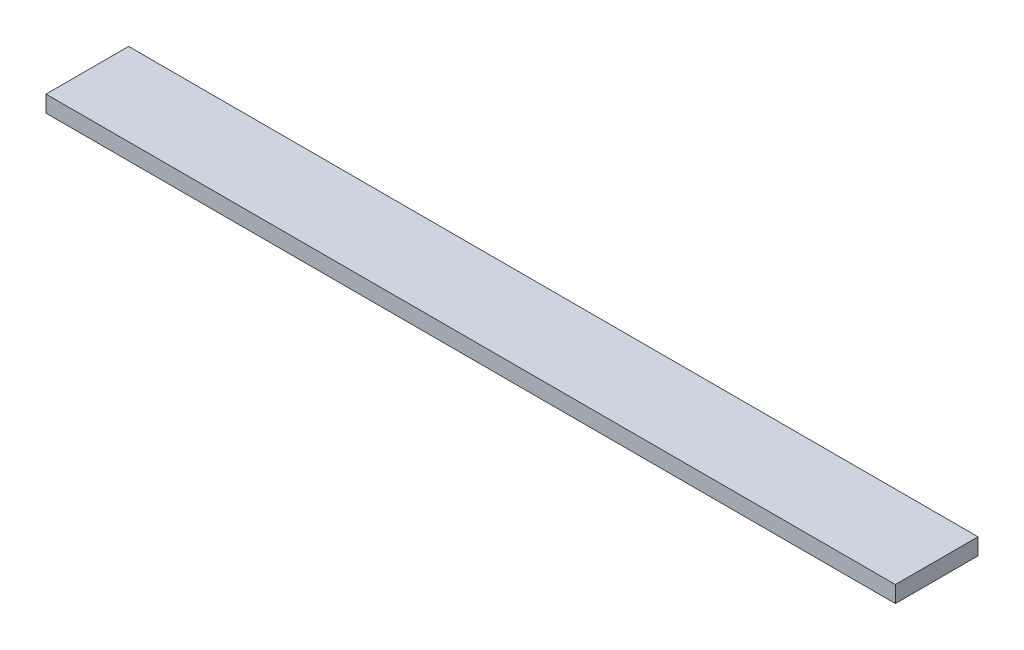
from build123d import *

# Parameters (mm, degrees)
SKETCH_1_W      = 257
SKETCH_1_H      = 25
EXTRUDE_1_DEPTH = 5


with BuildPart() as part:
    # 草图1 → 凸台-拉伸1 (new body)
    with BuildSketch(Plane(origin=(0, 0, 0), x_dir=(1, 0, 0), z_dir=(0, 1, 0))):
        Rectangle(SKETCH_1_W, SKETCH_1_H)
    extrude(amount=EXTRUDE_1_DEPTH)


solid = part.part
